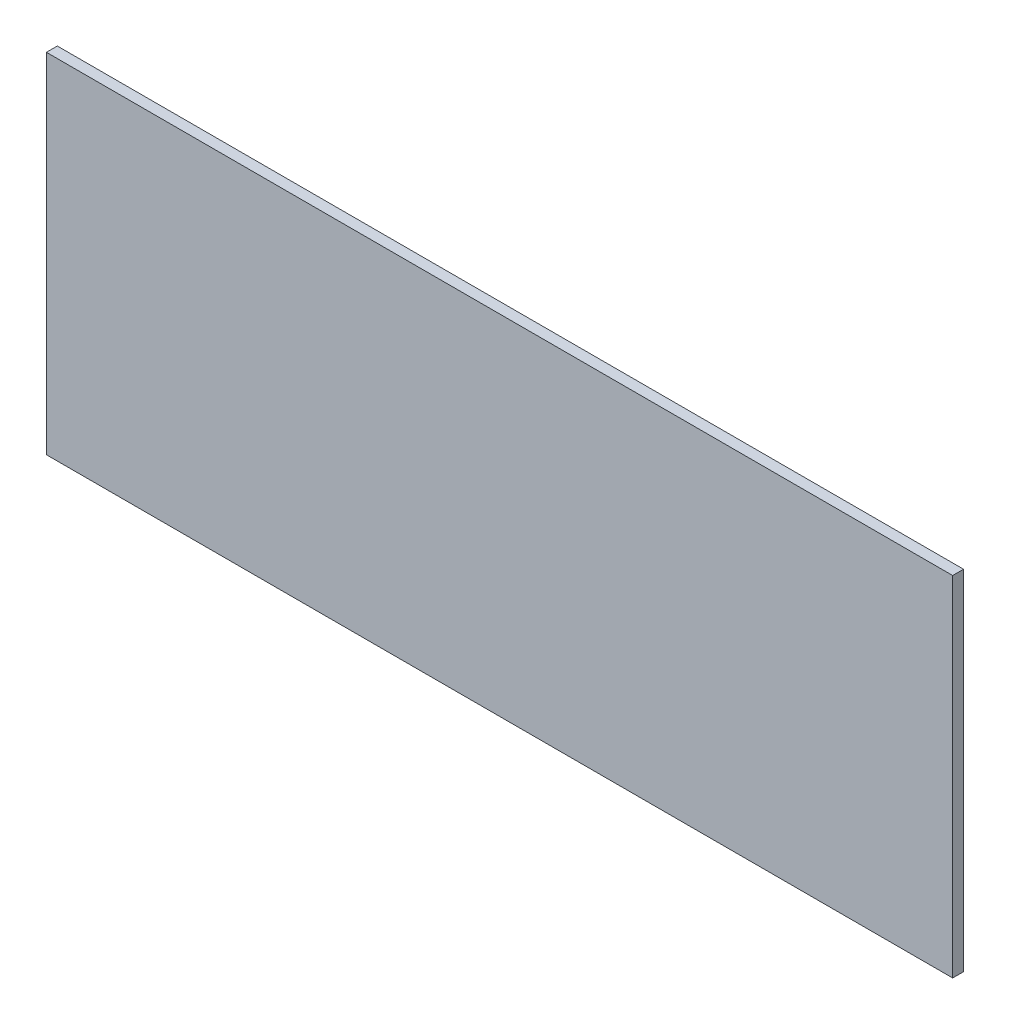
from build123d import *

# Parameters (mm, degrees)
ESQUISSE1_W        = 832
ESQUISSE1_H        = 320
BOSS_EXTRU_1_DEPTH = 10


with BuildPart() as part:
    # Esquisse1 → Boss.-Extru.1 (new body)
    with BuildSketch(Plane.XY):
        Rectangle(ESQUISSE1_W, ESQUISSE1_H)
    extrude(amount=BOSS_EXTRU_1_DEPTH)


solid = part.part
